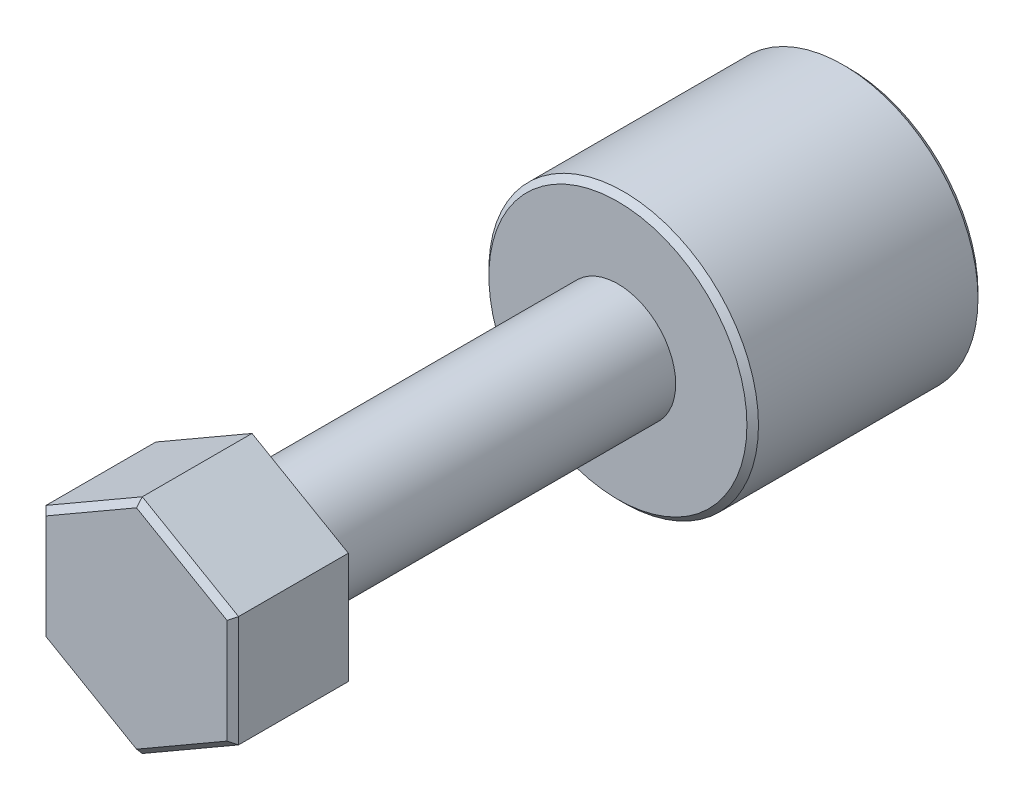
from build123d import *

# Parameters (mm, degrees)
SKETCH_1_R      = 7
EXTRUDE_1_DEPTH = 12
SKETCH_2_R      = 3
EXTRUDE_2_DEPTH = 25
EXTRUDE_3_DEPTH = 6
CHAMFER_1_SIZE  = 0.3


with BuildPart() as part:
    # 草图1 → 凸台-拉伸1 (new body)
    with BuildSketch(Plane.XY):
        Circle(SKETCH_1_R)
    extrude(amount=EXTRUDE_1_DEPTH)

    # 草图2 → 凸台-拉伸2 (add)
    with BuildSketch(Plane.XY.offset(12)):
        Circle(SKETCH_2_R)
    extrude(amount=EXTRUDE_2_DEPTH)

    # 草图3 → 凸台-拉伸3 (add)
    with BuildSketch(Plane.XY.offset(37)):
        Polygon((5, 2.886751346), (0, 5.773502692), (-5, 2.886751346), (-5, -2.886751346), (0, -5.773502692), (5, -2.886751346), align=None)
    extrude(amount=-EXTRUDE_3_DEPTH)

    # 倒角1
    chamfer_1_edges = [part.edges().sort_by_distance(p)[0] for p in [
        (5, 0, 37),
        (2.5, 4.330127019, 37),
        (-2.5, 4.330127019, 37),
        (-5, 0, 37),
        (-2.5, -4.330127019, 37),
        (2.5, -4.330127019, 37),
        (-7, 0, 0),
        (-7, 0, 12),
    ]]
    chamfer(chamfer_1_edges, length=CHAMFER_1_SIZE)


solid = part.part
